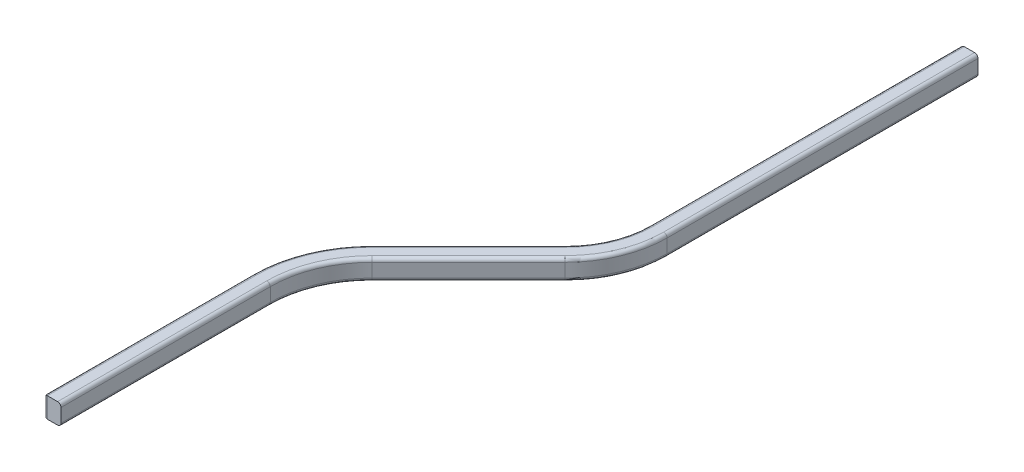
from build123d import *

# Parameters (mm, degrees)
RESSALTO_EXTRUS_O1_DEPTH = 6
FILETE1_R                = 1


with BuildPart() as part:
    # Esboço2 → Ressalto-extrusão1 (new body)
    with BuildSketch(Plane(origin=(0, 0, 0), x_dir=(1, 0, 0), z_dir=(0, 1, 0))):
        with BuildLine():
            Line((-11.375, -102.828494661), (-11.375, -41.212577741))
            ThreePointArc((-11.375, -41.212577741), (-8.710783638, -27.818657608), (-1.123737342, -16.463840399))
            Line((-1.123737342, -16.463840399), (27.30266953, 11.962566472))
            ThreePointArc((27.30266953, 11.962566472), (32.721988313, 20.073150192), (34.625, 29.640236002))
            Line((34.625, 29.640236002), (34.625, 121.17150534))
            Line((34.625, 121.17150534), (39.625, 121.17150534))
            Line((39.625, 121.17150534), (39.625, 29.640236002))
            ThreePointArc((39.625, 29.640236002), (37.341385975, 18.159733031), (30.838203436, 8.427032566))
            Line((30.838203436, 8.427032566), (2.411796564, -19.999374305))
            ThreePointArc((2.411796564, -19.999374305), (-4.091385975, -29.73207477), (-6.375, -41.212577741))
            Line((-6.375, -41.212577741), (-6.375, -102.828494661))
            Line((-6.375, -102.828494661), (-11.375, -102.828494661))
        make_face()
    extrude(amount=RESSALTO_EXTRUS_O1_DEPTH)

    # Filete1
    filete1_edges = [part.edges().sort_by_distance(p)[0] for p in [
        (39.625, 0, -75.405870671),
        (37.341385975, 0, -18.159733031),
        (32.721988313, 6, -20.073150192),
        (16.625, 0, 5.78617087),
        (-4.091385975, 0, 29.73207477),
        (-6.375, 0, 72.020536201),
        (-11.375, 0, 72.020536201),
        (-8.710783638, 0, 27.818657608),
        (13.089466094, 0, 2.250636964),
        (32.721988313, 0, -20.073150192),
        (34.625, 0, -75.405870671),
        (13.089466094, 6, 2.250636964),
        (-8.710783638, 6, 27.818657608),
        (-11.375, 3, 102.828494661),
        (34.625, 3, -121.17150534),
        (-11.375, 6, 72.020536201),
        (-6.375, 6, 72.020536201),
        (-4.091385975, 6, 29.73207477),
        (16.625, 6, 5.78617087),
        (37.341385975, 6, -18.159733031),
        (39.625, 6, -75.405870671),
        (34.625, 6, -75.405870671),
    ]]
    fillet(filete1_edges, radius=FILETE1_R)


solid = part.part
